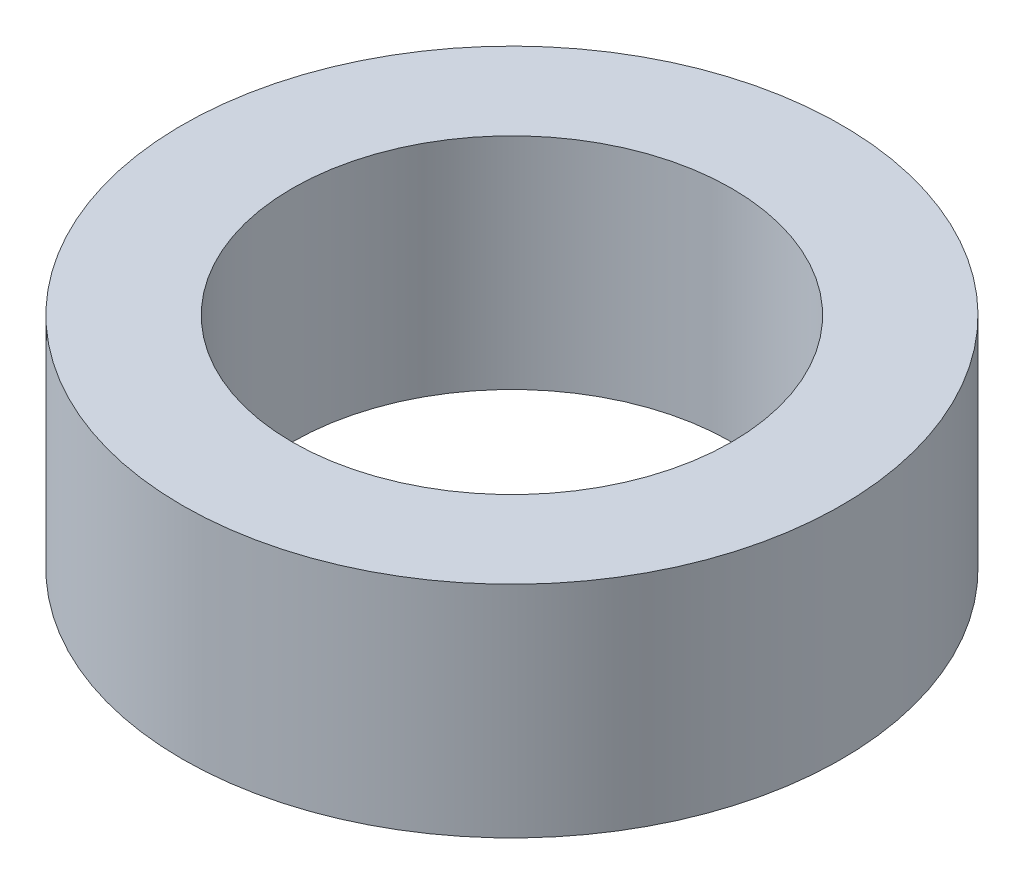
from build123d import *

# Parameters (mm, degrees)
SKETCH_1_R      = 7.5
SKETCH_1_R_2    = 5
EXTRUDE_1_DEPTH = 5


with BuildPart() as part:
    # 草图1 → 凸台-拉伸1 (new body)
    with BuildSketch(Plane(origin=(0, 0, 0), x_dir=(1, 0, 0), z_dir=(0, 1, 0))):
        with Locations(Location((0, 0, 0), (0, 0, 270))):
            Circle(SKETCH_1_R)
        with Locations(Location((0, 0, 0), (0, 0, 270))):
            Circle(SKETCH_1_R_2, mode=Mode.SUBTRACT)
    extrude(amount=EXTRUDE_1_DEPTH)


solid = part.part
